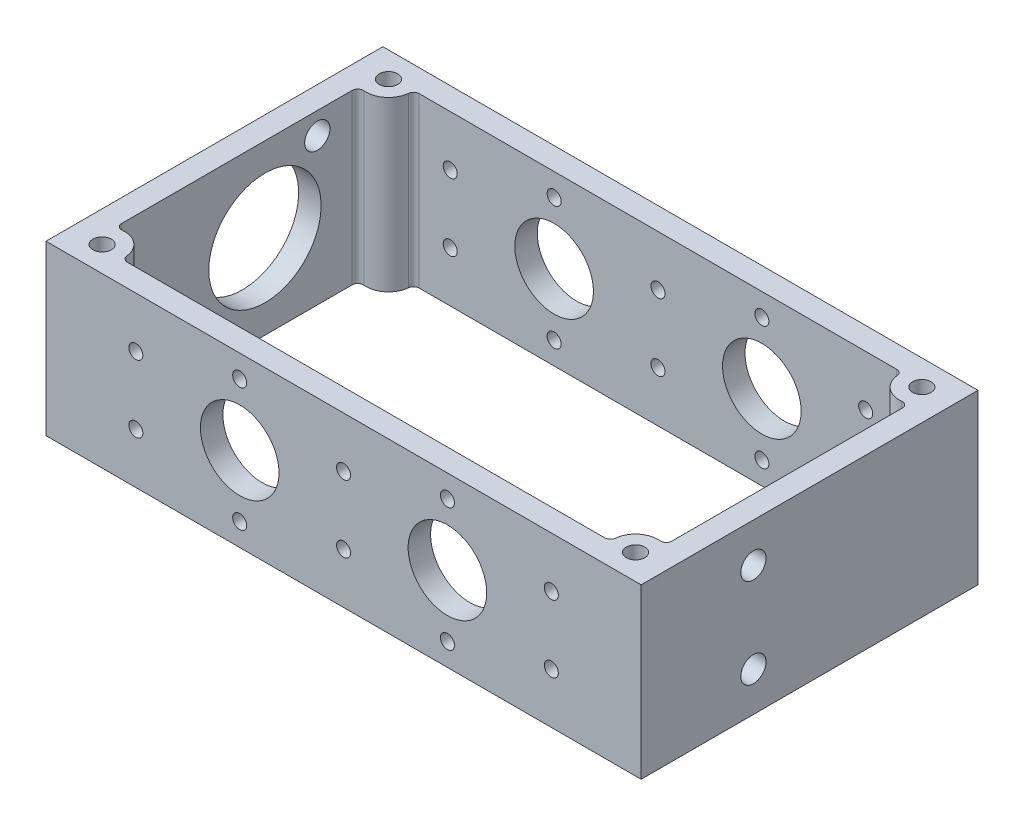
from build123d import *

# Parameters (mm, degrees)
SKETCH_1_W                                 = 106
SKETCH_1_H                                 = 60
EXTRUDE_1_DEPTH                            = 15
SKETCH_4_W                                 = 98
SKETCH_4_H                                 = 52
CUT_EXTRUDE_3_DEPTH                        = 68.88961629
SKETCH_5_R                                 = 2
EXTRUDE_2_DEPTH                            = 30
MIRROR_3_COPY_1_SKETCH_R                   = 2
MIRROR_3_COPY_1_DEPTH                      = 30
SKETCH_3_R                                 = 1.65
CUT_EXTRUDE_2_DEPTH                        = 10
CUT_EXTRUDE_4_REACH                        = 113.18
SKETCH_6_R                                 = 10
SKETCH_6_R_2                               = 2.25
SKETCH_7_R                                 = 2.25
CUT_EXTRUDE_5_DEPTH                        = 108.373181009
SKETCH_8_R                                 = 7
CUT_EXTRUDE_6_DEPTH                        = 82.449370777
HOLE_WIZARD_M3_1_D                         = 2.5
MIRROR_4_AT_THE_SECOND_PLANE_COPY_1_SKET_R = 7
MIRROR_4_AT_THE_SECOND_PLANE_COPY_1_DEPTH  = 82.449370777
MIRROR_4_AT_THE_SECOND_PLANE_COPY_2_D      = 2.5
EXTRUDE_START                              = -30
EXTRUDE_3_DEPTH                            = 30
FILLET_1_R                                 = 1


with BuildPart() as part:
    # 草图1 → 凸台-拉伸1 (new, symmetric)
    with BuildSketch(Plane(origin=(0, 0, 0), x_dir=(1, 0, 0), z_dir=(0, 1, 0))):
        Rectangle(SKETCH_1_W, SKETCH_1_H)
    extrude(amount=EXTRUDE_1_DEPTH, both=True)

    # 草图4 → 切除-拉伸3 (cut, through all)
    with BuildSketch(Plane(origin=(0, 15, 0), x_dir=(1, 0, 0), z_dir=(0, 1, 0))):
        Rectangle(SKETCH_4_W, SKETCH_4_H)
    extrude(amount=-CUT_EXTRUDE_3_DEPTH, mode=Mode.SUBTRACT)

    # 草图5 → 凸台-拉伸2 (add)
    with BuildSketch(Plane(origin=(0, 15, 0), x_dir=(1, 0, 0), z_dir=(0, 1, 0))):
        with Locations((47.5, 25.5)):
            Circle(SKETCH_5_R)
    extrude_2 = extrude(amount=-EXTRUDE_2_DEPTH)

    # 镜向2: 凸台-拉伸2 across plane
    add(extrude_2.mirror(Plane(origin=(0, 0, 0), x_dir=(0, 0, 1), z_dir=(1, 0, 0))))

    # 镜向3: 凸台-拉伸2 across plane
    add(extrude_2.mirror(Plane.XY))

    # 镜向3 copy 1 sketch → 镜向3 copy 1 (add)
    with BuildSketch(Plane(origin=(0, 15, 0), x_dir=(-1, 0, 0), z_dir=(0, 1, 0))):
        with Locations((47.5, 25.5)):
            Circle(MIRROR_3_COPY_1_SKETCH_R)
    extrude(amount=-MIRROR_3_COPY_1_DEPTH)

    # 草图3 → 切除-拉伸2 (cut)
    with BuildSketch(Plane(origin=(0, 15, 0), x_dir=(1, 0, 0), z_dir=(0, 1, 0))):
        with Locations(Location((47.5, 25.5, 0), (0, 0, 270))):
            Circle(SKETCH_3_R)
        with Locations(Location((47.5, -25.5, 0), (0, 0, 90))):
            Circle(SKETCH_3_R)
        with Locations(Location((-47.5, -25.5, 0), (0, 0, 270))):
            Circle(SKETCH_3_R)
        with Locations(Location((-47.5, 25.5, 0), (0, 0, 90))):
            Circle(SKETCH_3_R)
    cut_extrude_2 = extrude(amount=-CUT_EXTRUDE_2_DEPTH, mode=Mode.SUBTRACT)

    # 镜向1: 切除-拉伸2 across plane
    add(cut_extrude_2.mirror(Plane.ZX), mode=Mode.SUBTRACT)

    # 草图6 → 切除-拉伸4 (cut, up to next)
    with BuildSketch(Plane.ZY.offset(53), mode=Mode.PRIVATE) as cut_extrude_4_sk1:
        with Locations((-5, 0)):
            Circle(SKETCH_6_R)
    cut_extrude_4_tool1 = extrude(cut_extrude_4_sk1.sketch, amount=-CUT_EXTRUDE_4_REACH, mode=Mode.PRIVATE) & part.part
    # 草图6 → 切除-拉伸4 (cut, up to next)
    with BuildSketch(Plane.ZY.offset(53), mode=Mode.PRIVATE) as cut_extrude_4_sk2:
        with Locations((-14.32042034, 11.107644425)):
            Circle(SKETCH_6_R_2)
    cut_extrude_4_tool2 = extrude(cut_extrude_4_sk2.sketch, amount=-CUT_EXTRUDE_4_REACH, mode=Mode.PRIVATE) & part.part
    # 草图6 → 切除-拉伸4 (cut, up to next)
    with BuildSketch(Plane.ZY.offset(53), mode=Mode.PRIVATE) as cut_extrude_4_sk3:
        with Locations((4.32042034, -11.107644425)):
            Circle(SKETCH_6_R_2)
    cut_extrude_4_tool3 = extrude(cut_extrude_4_sk3.sketch, amount=-CUT_EXTRUDE_4_REACH, mode=Mode.PRIVATE) & part.part
    add(cut_extrude_4_tool1.solids().sort_by_distance((-53, 0, -5))[0], mode=Mode.SUBTRACT)
    add(cut_extrude_4_tool2.solids().sort_by_distance((-53, 11.107644, -14.32042))[0], mode=Mode.SUBTRACT)
    add(cut_extrude_4_tool3.solids().sort_by_distance((-53, -11.107644, 4.32042))[0], mode=Mode.SUBTRACT)

    # 草图7 → 切除-拉伸5 (cut, through all)
    with BuildSketch(Plane.ZY.offset(-49)):
        with Locations((10, 8)):
            Circle(SKETCH_7_R)
        with Locations((10, -8)):
            Circle(SKETCH_7_R)
    extrude(amount=-CUT_EXTRUDE_5_DEPTH, mode=Mode.SUBTRACT)

    # 草图8 → 切除-拉伸6 (cut, through all)
    with BuildSketch(Plane.XY.offset(30)):
        with Locations((18.5, 0)):
            Circle(SKETCH_8_R)
    cut_extrude_6 = extrude(amount=-CUT_EXTRUDE_6_DEPTH, mode=Mode.SUBTRACT)

    # M3 螺纹孔1 (through all)
    with Locations(Plane(origin=(0, 6, 30), x_dir=(1, 0, 0), z_dir=(0, 0, 1))):
        with Locations((0, 0), (18.5, 5), (37, 0)):
            hole_wizard_m3_1 = Hole(HOLE_WIZARD_M3_1_D / 2)

    # 镜向4: 切除-拉伸6, M3 螺纹孔1 across plane
    add(cut_extrude_6.mirror(Plane(origin=(0, 0, 0), x_dir=(0, 0, 1), z_dir=(1, 0, 0))), mode=Mode.SUBTRACT)
    add(hole_wizard_m3_1.mirror(Plane(origin=(0, 0, 0), x_dir=(0, 0, 1), z_dir=(1, 0, 0))), mode=Mode.SUBTRACT)

    # 镜向4 at the second plane: 切除-拉伸6, M3 螺纹孔1 across plane
    add(cut_extrude_6.mirror(Plane.ZX), mode=Mode.SUBTRACT)
    add(hole_wizard_m3_1.mirror(Plane.ZX), mode=Mode.SUBTRACT)

    # 镜向4 at the second plane copy 1 sket → 镜向4 at the second plane copy 1 (cut, through all)
    with BuildSketch(Plane(origin=(0, 0, 30), x_dir=(-1, 0, 0), z_dir=(0, 0, 1))):
        with Locations((18.5, 0)):
            Circle(MIRROR_4_AT_THE_SECOND_PLANE_COPY_1_SKET_R)
    extrude(amount=-MIRROR_4_AT_THE_SECOND_PLANE_COPY_1_DEPTH, mode=Mode.SUBTRACT)

    # 镜向4 at the second plane copy 2 (through all)
    with Locations(Plane(origin=(0, -6, 30), x_dir=(-1, 0, 0), z_dir=(0, 0, 1))):
        with Locations((0, 0), (18.5, 5), (37, 0)):
            Hole(MIRROR_4_AT_THE_SECOND_PLANE_COPY_2_D / 2)

    # 草图10 → 凸台-拉伸3 (add)
    with BuildSketch(Plane(origin=(0, 15, 0), x_dir=(1, 0, 0), z_dir=(0, 1, 0)).offset(EXTRUDE_START)):
        with BuildLine():
            ThreePointArc((-49, 21.791900756), (-45.06062414, 22.329913974), (-43.531373033, 26))
            Line((-43.531373033, 26), (-45.563508327, 26))
            ThreePointArc((-45.563508327, 26), (-46.562796629, 23.733180869), (-49, 24.177124344))
            Line((-49, 24.177124344), (-49, 21.791900756))
        make_face()
        with BuildLine():
            Line((45.563508327, 26), (43.531373033, 26))
            ThreePointArc((43.531373033, 26), (45.06062414, 22.329913974), (49, 21.791900756))
            Line((49, 21.791900756), (49, 24.177124344))
            ThreePointArc((49, 24.177124344), (46.562796629, 23.733180869), (45.563508327, 26))
        make_face()
        with BuildLine():
            ThreePointArc((-43.531373033, -26), (-45.06062414, -22.329913974), (-49, -21.791900756))
            Line((-49, -21.791900756), (-49, -24.177124344))
            ThreePointArc((-49, -24.177124344), (-46.562796629, -23.733180869), (-45.563508327, -26))
            Line((-45.563508327, -26), (-43.531373033, -26))
        make_face()
        with BuildLine():
            Line((49, -24.177124344), (49, -21.791900756))
            ThreePointArc((49, -21.791900756), (45.06062414, -22.329913974), (43.531373033, -26))
            Line((43.531373033, -26), (45.563508327, -26))
            ThreePointArc((45.563508327, -26), (46.562796629, -23.733180869), (49, -24.177124344))
        make_face()
    extrude(amount=EXTRUDE_3_DEPTH)

    # 圆角1
    fillet_1_edges = [part.edges().sort_by_distance(p)[0] for p in [
        (49, 0, -21.791900756),
        (43.531373033, 0, -26),
        (43.531373033, 0, 26),
        (49, 0, 21.791900756),
        (-49, 0, 21.791900756),
        (-43.531373033, 0, 26),
        (-43.531373033, 0, -26),
        (-49, 0, -21.791900756),
    ]]
    fillet(fillet_1_edges, radius=FILLET_1_R)


solid = part.part
